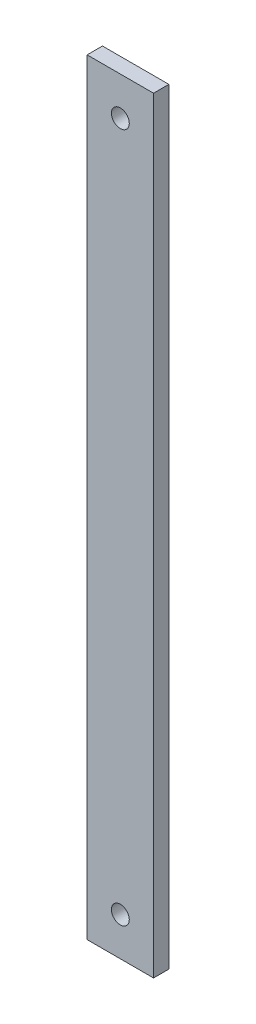
from build123d import *

# Parameters (mm, degrees)
SZKIC1_W                    = 13
SZKIC1_H                    = 150
SZKIC1_R                    = 1.75
DODANIE_WYCI_GNI_CIE1_DEPTH = 3


with BuildPart() as part:
    # Szkic1 → Dodanie-wyciągnięcie1 (new body)
    with BuildSketch(Plane.XY):
        Rectangle(SZKIC1_W, SZKIC1_H)
        with Locations((0, 67.5)):
            Circle(SZKIC1_R, mode=Mode.SUBTRACT)
        with Locations((0, -67.5)):
            Circle(SZKIC1_R, mode=Mode.SUBTRACT)
    extrude(amount=DODANIE_WYCI_GNI_CIE1_DEPTH)


solid = part.part
